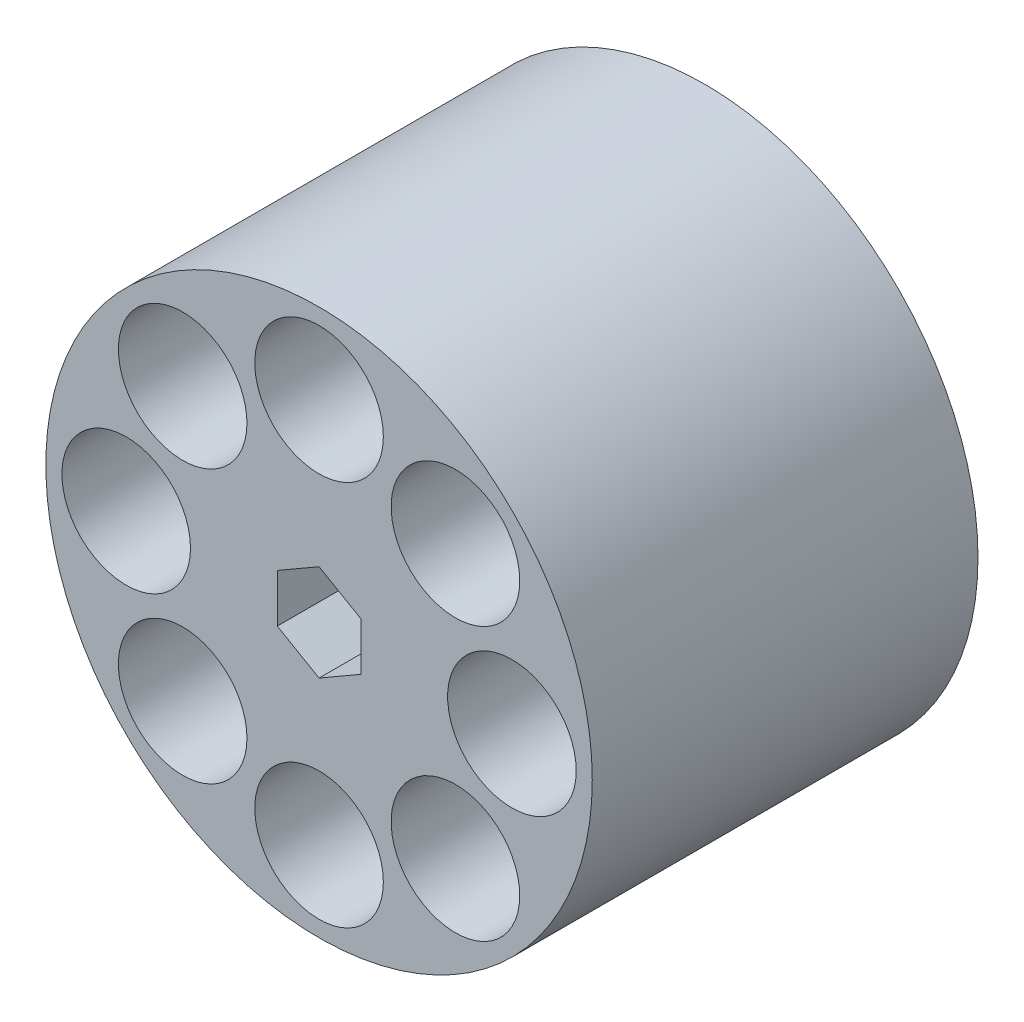
from build123d import *

# Parameters (mm, degrees)
SKETCH_1_R          = 8.5
EXTRUDE_1_DEPTH     = 12
SKETCH_2_R          = 1
CUT_EXTRUDE_1_DEPTH = 20
CUT_EXTRUDE_2_DEPTH = 8
SKETCH_4_R          = 4.4
CUT_EXTRUDE_3_DEPTH = 2
SKETCH_5_R          = 2
CUT_EXTRUDE_4_DEPTH = 4


with BuildPart() as part:
    # ｽｹｯﾁ1 → ﾎﾞｽ - 押し出し1 (new body)
    with BuildSketch(Plane.XY):
        Circle(SKETCH_1_R)
    extrude(amount=EXTRUDE_1_DEPTH)

    # ｽｹｯﾁ2 → ｶｯﾄ - 押し出し1 (cut)
    with BuildSketch(Plane.XY.offset(12)):
        with Locations((0, 6)):
            Circle(SKETCH_2_R)
        with Locations((4.242640687, 4.242640687)):
            Circle(SKETCH_2_R)
        with Locations((6, 0)):
            Circle(SKETCH_2_R)
        with Locations((4.242640687, -4.242640687)):
            Circle(SKETCH_2_R)
        with Locations((0, -6)):
            Circle(SKETCH_2_R)
        with Locations((-4.242640687, -4.242640687)):
            Circle(SKETCH_2_R)
        with Locations((-6, 0)):
            Circle(SKETCH_2_R)
        with Locations((-4.242640687, 4.242640687)):
            Circle(SKETCH_2_R)
    extrude(amount=-CUT_EXTRUDE_1_DEPTH, mode=Mode.SUBTRACT)

    # ｽｹｯﾁ3 → ｶｯﾄ - 押し出し2 (cut)
    with BuildSketch(Plane.XY.offset(12)):
        Polygon((0, 1.5), (-1.299038106, 0.75), (-1.299038106, -0.75), (0, -1.5), (1.299038106, -0.75), (1.299038106, 0.75), align=None)
    extrude(amount=-CUT_EXTRUDE_2_DEPTH, mode=Mode.SUBTRACT)

    # ｽｹｯﾁ4 → ｶｯﾄ - 押し出し3 (cut)
    with BuildSketch(Plane(origin=(0, 0, 0), x_dir=(-1, 0, 0), z_dir=(0, 0, -1))):
        Circle(SKETCH_4_R)
    extrude(amount=-CUT_EXTRUDE_3_DEPTH, mode=Mode.SUBTRACT)

    # ｽｹｯﾁ5 → ｶｯﾄ - 押し出し4 (cut)
    with BuildSketch(Plane.XY.offset(12)):
        with Locations((0, 6)):
            Circle(SKETCH_5_R)
        with Locations((4.242640687, 4.242640687)):
            Circle(SKETCH_5_R)
        with Locations((6, 0)):
            Circle(SKETCH_5_R)
        with Locations((4.242640687, -4.242640687)):
            Circle(SKETCH_5_R)
        with Locations((0, -6)):
            Circle(SKETCH_5_R)
        with Locations((-4.242640687, -4.242640687)):
            Circle(SKETCH_5_R)
        with Locations((-6, 0)):
            Circle(SKETCH_5_R)
        with Locations((-4.242640687, 4.242640687)):
            Circle(SKETCH_5_R)
    extrude(amount=-CUT_EXTRUDE_4_DEPTH, mode=Mode.SUBTRACT)


solid = part.part
